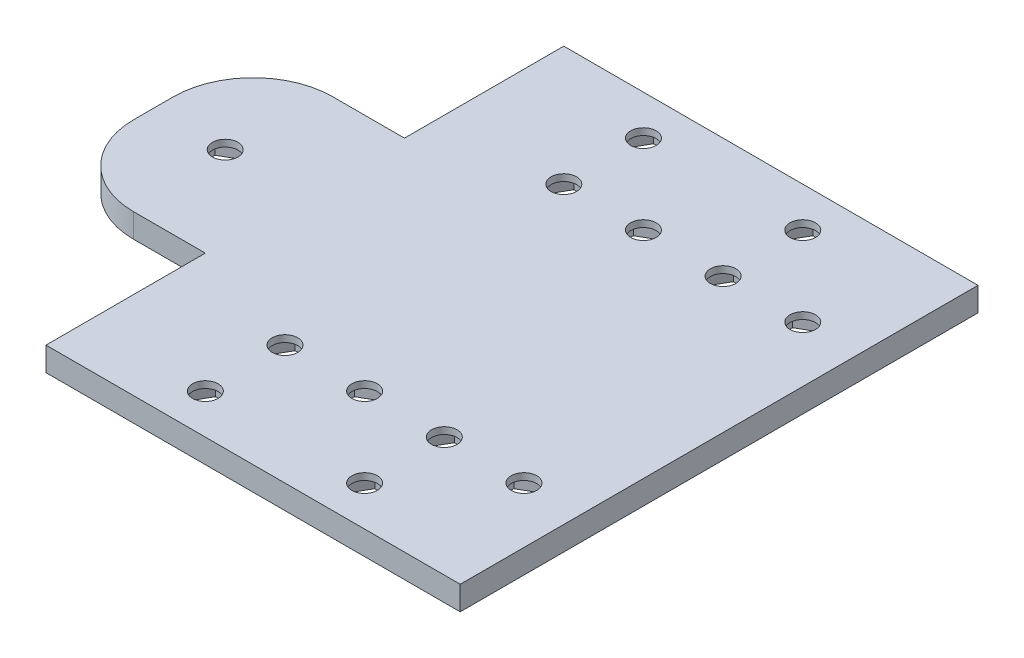
from build123d import *

# Parameters (mm, degrees)
BOSS_EXTRUDE1_DEPTH = 3
CUT_EXTRUDE1_DEPTH  = 2.15
HOLE1_D             = 3.2
FILLET1_R           = 10


with BuildPart() as part:
    # Sketch1 → Boss-Extrude1 (new body)
    with BuildSketch(Plane(origin=(0, 0, 0), x_dir=(1, 0, 0), z_dir=(0, 1, 0))):
        Polygon((0, 0), (-52, 0), (-52, -20), (-71, -20), (-71, -45), (-52, -45), (-52, -65), (0, -65), align=None)
    extrude(amount=BOSS_EXTRUDE1_DEPTH)

    # Sketch2 → Cut-Extrude1 (cut)
    with BuildSketch(Plane.XZ):
        Polygon((-7, 46.507030871), (-3.975, 48.253515436), (-3.975, 51.746484564), (-7, 53.492969129), (-10.025, 51.746484564), (-10.025, 48.253515436), align=None)
        Polygon((-35.253515436, 56.975), (-33.507030871, 60), (-35.253515436, 63.025), (-38.746484564, 63.025), (-40.492969129, 60), (-38.746484564, 56.975), align=None)
        Polygon((-20.492969129, 60), (-18.746484564, 56.975), (-15.253515436, 56.975), (-13.507030871, 60), (-15.253515436, 63.025), (-18.746484564, 63.025), align=None)
        Polygon((-18.746484564, 46.975), (-15.253515436, 46.975), (-13.507030871, 50), (-15.253515436, 53.025), (-18.746484564, 53.025), (-20.492969129, 50), align=None)
        Polygon((-38.746484564, 46.975), (-35.253515436, 46.975), (-33.507030871, 50), (-35.253515436, 53.025), (-38.746484564, 53.025), (-40.492969129, 50), align=None)
        Polygon((-38.746484564, 11.975), (-35.253515436, 11.975), (-33.507030871, 15), (-35.253515436, 18.025), (-38.746484564, 18.025), (-40.492969129, 15), align=None)
        Polygon((-18.746484564, 11.975), (-15.253515436, 11.975), (-13.507030871, 15), (-15.253515436, 18.025), (-18.746484564, 18.025), (-20.492969129, 15), align=None)
        Polygon((-15.253515436, 1.975), (-13.507030871, 5), (-15.253515436, 8.025), (-18.746484564, 8.025), (-20.492969129, 5), (-18.746484564, 1.975), align=None)
        Polygon((-35.253515436, 8.025), (-38.746484564, 8.025), (-40.492969129, 5), (-38.746484564, 1.975), (-35.253515436, 1.975), (-33.507030871, 5), align=None)
        Polygon((-27, 46.507030871), (-23.975, 48.253515436), (-23.975, 51.746484564), (-27, 53.492969129), (-30.025, 51.746484564), (-30.025, 48.253515436), align=None)
        Polygon((-23.975, 13.253515436), (-23.975, 16.746484564), (-27, 18.492969129), (-30.025, 16.746484564), (-30.025, 13.253515436), (-27, 11.507030871), align=None)
        Polygon((-58.975, 30.753515436), (-58.975, 34.246484564), (-62, 35.992969129), (-65.025, 34.246484564), (-65.025, 30.753515436), (-62, 29.007030871), align=None)
        Polygon((-3.975, 16.746484564), (-7, 18.492969129), (-10.025, 16.746484564), (-10.025, 13.253515436), (-7, 11.507030871), (-3.975, 13.253515436), align=None)
    extrude(amount=-CUT_EXTRUDE1_DEPTH, mode=Mode.SUBTRACT)

    # Hole1 (through all)
    with Locations(Plane(origin=(-37, 0, 5), x_dir=(0, 0, -1), z_dir=(0, -1, 0))):
        with Locations((0, 0), (-10, 0), (-10, 20), (0, 20), (-10, 10), (-45, 10), (-45, 20), (-55, 20), (-55, 0), (-45, 0), (-27.5, -25), (-10, 30), (-45, 30)):
            Hole(HOLE1_D / 2)

    # Fillet1
    fillet1_edges = [part.edges().sort_by_distance(p)[0] for p in [
        (-71, 1.5, 20),
        (-71, 1.5, 45),
    ]]
    fillet(fillet1_edges, radius=FILLET1_R)


solid = part.part
